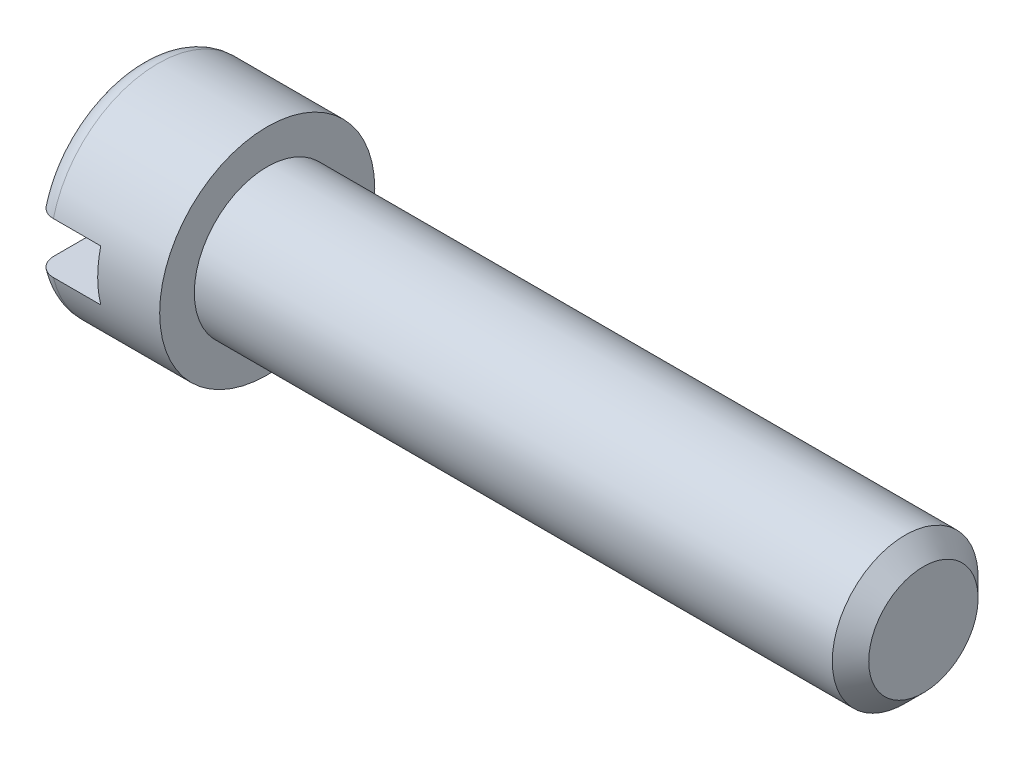
from build123d import *

# Parameters (mm, degrees)
CHANFREIN1_SIZE              = 0.5
CONG_1_R                     = 0.5
ENL_V_MAT_EXTRU_1_DEPTH      = 22.901027373
ENL_V_MAT_EXTRU_1_DEPTH_BACK = 22.901027373
ESQUISSE2_W                  = 1.8
ESQUISSE2_H                  = 1.4


with BuildPart() as part:
    # Esquisse1 → Révolution1 (revolve)
    with BuildSketch(Plane.XY, mode=Mode.PRIVATE) as r_volution1_sk:
        Polygon((0, 0), (0, 2), (-18, 2), (-18, 2.95), (-21.5, 2.95), (-21.5, 0), align=None)
    revolve(r_volution1_sk.sketch.rotate(Axis((-6, 0, 0), (1, 0, 0)), 90), axis=Axis((-6, 0, 0), (1, 0, 0)))

    # Chanfrein1
    chanfrein1_edges = [part.edges().sort_by_distance(p)[0] for p in [
        (0, 0, -2),
    ]]
    chamfer(chanfrein1_edges, length=CHANFREIN1_SIZE)

    # Congé1
    cong_1_edges = [part.edges().sort_by_distance(p)[0] for p in [
        (-21.5, 0, -2.95),
    ]]
    fillet(cong_1_edges, radius=CONG_1_R)

    # Esquisse2 → Enlèv. mat.-Extru.1 (cut, two sides: drawn at the far end of the back side and taken through both)
    with BuildSketch(Plane.XY.offset(-ENL_V_MAT_EXTRU_1_DEPTH_BACK)):
        with Locations((-20.6, 0)):
            Rectangle(ESQUISSE2_W, ESQUISSE2_H)
    extrude(amount=ENL_V_MAT_EXTRU_1_DEPTH + ENL_V_MAT_EXTRU_1_DEPTH_BACK, mode=Mode.SUBTRACT)


solid = part.part
